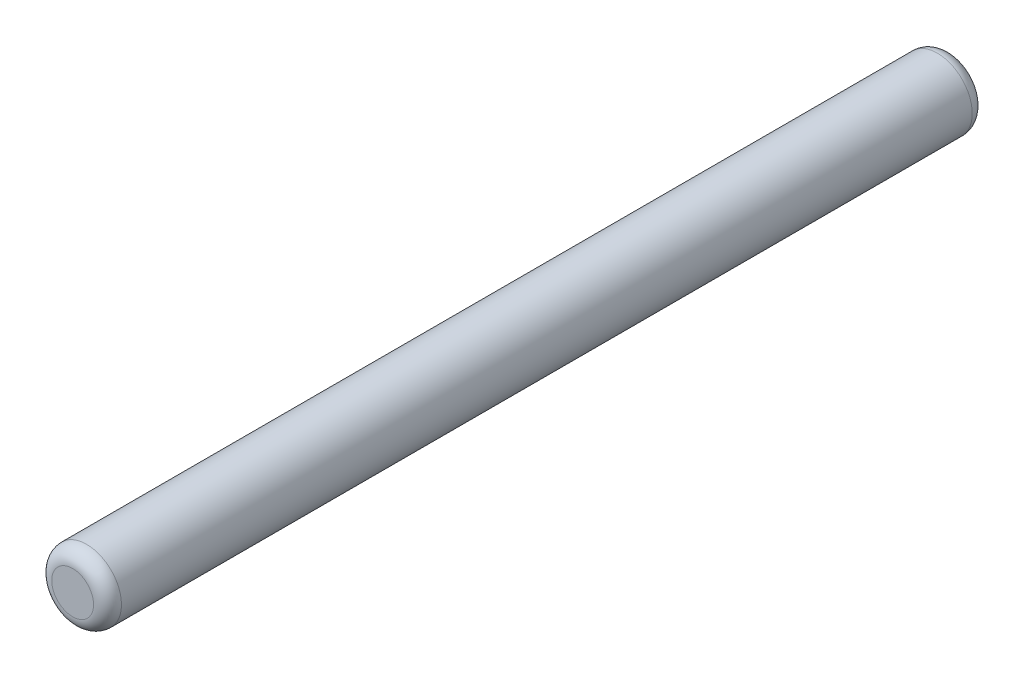
from build123d import *

# Parameters (mm, degrees)
SKETCH1_R           = 1.5875
BOSS_EXTRUDE1_DEPTH = 40.005
FILLET2_R           = 0.635


with BuildPart() as part:
    # Sketch1 → Boss-Extrude1 (new body)
    with BuildSketch(Plane.XY):
        Circle(SKETCH1_R)
    extrude(amount=BOSS_EXTRUDE1_DEPTH)

    # Fillet2
    fillet2_edges = [part.edges().sort_by_distance(p)[0] for p in [
        (-1.5875, 0, 0),
        (-1.5875, 0, 40.005),
    ]]
    fillet(fillet2_edges, radius=FILLET2_R)


solid = part.part
